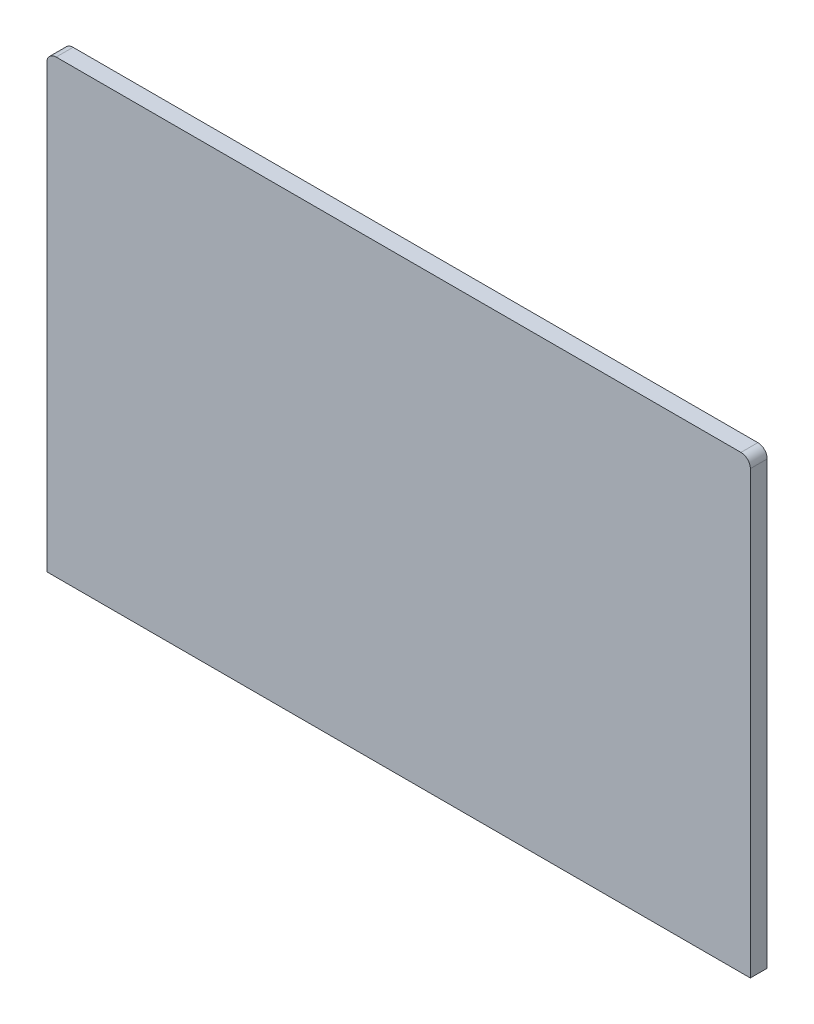
from build123d import *

# Parameters (mm, degrees)
ESQUISSE1_W        = 74.95
ESQUISSE1_H        = 47.99
BOSS_EXTRU_1_DEPTH = 1.8
CONG_1_R           = 1


with BuildPart() as part:
    # Esquisse1 → Boss.-Extru.1 (new body)
    with BuildSketch(Plane.XY):
        Rectangle(ESQUISSE1_W, ESQUISSE1_H)
    extrude(amount=BOSS_EXTRU_1_DEPTH)

    # Congé1
    cong_1_edges = [part.edges().sort_by_distance(p)[0] for p in [
        (-37.475, 23.995, 0.9),
        (37.475, 23.995, 0.9),
    ]]
    fillet(cong_1_edges, radius=CONG_1_R)


solid = part.part
